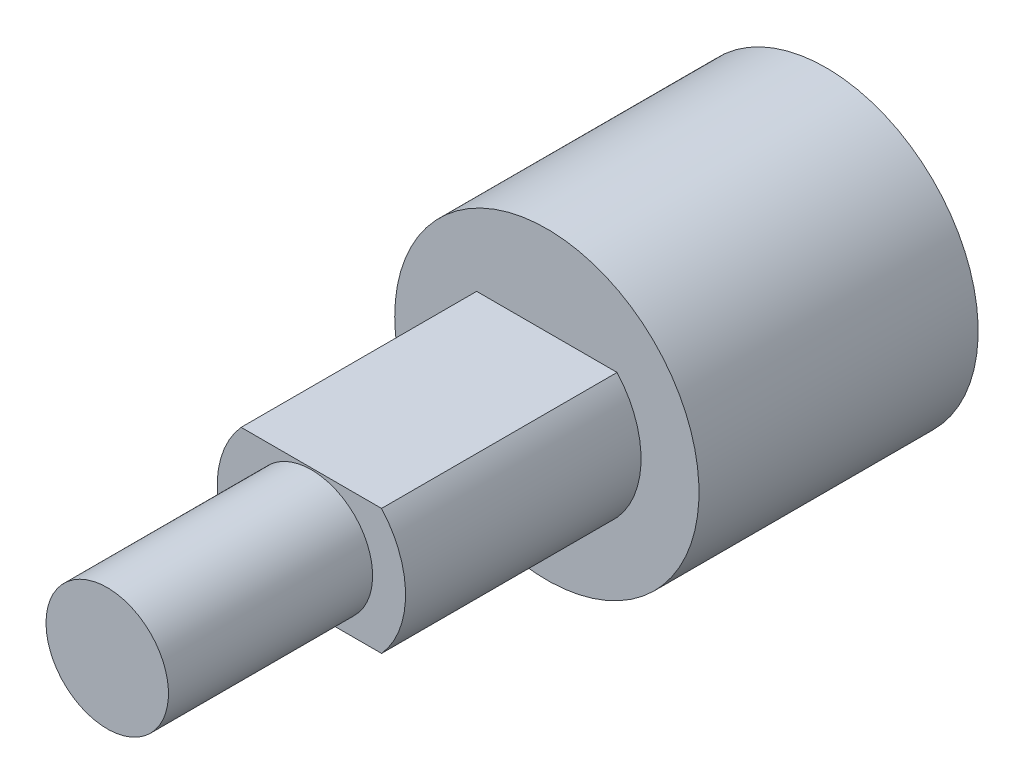
from build123d import *

# Parameters (mm, degrees)
SKETCH1_R           = 4.845
SKETCH1_R_2         = 1.5
BOSS_EXTRUDE1_DEPTH = 8.89
SKETCH2_R           = 1.5
BOSS_EXTRUDE2_DEPTH = 7.5
SKETCH3_R           = 1.95
BOSS_EXTRUDE3_DEPTH = 6.5


with BuildPart() as part:
    # Sketch1 → Boss-Extrude1 (new body)
    with BuildSketch(Plane.XY):
        with Locations(Location((0, 0, 0), (0, 0, 180))):
            Circle(SKETCH1_R)
        with Locations(Location((0, 0, 0), (0, 0, 180))):
            Circle(SKETCH1_R_2, mode=Mode.SUBTRACT)
    extrude(amount=BOSS_EXTRUDE1_DEPTH)

    # Sketch2 → Boss-Extrude2 (add)
    with BuildSketch(Plane.XY.offset(8.89)):
        with BuildLine():
            Line((-2.236067977, 2), (2.236067977, 2))
            ThreePointArc((2.236067977, 2), (3, 0), (2.236067977, -2))
            Line((2.236067977, -2), (-2.236067977, -2))
            ThreePointArc((-2.236067977, -2), (-3, 0), (-2.236067977, 2))
        make_face()
        with Locations(Location((0, 0, 0), (0, 0, 180))):
            Circle(SKETCH2_R, mode=Mode.SUBTRACT)
    extrude(amount=BOSS_EXTRUDE2_DEPTH)

    # Sketch3 → Boss-Extrude3 (add)
    with BuildSketch(Plane.XY.offset(16.39)):
        with Locations(Location((0, 0, 0), (0, 0, 180))):
            Circle(SKETCH3_R)
    extrude(amount=BOSS_EXTRUDE3_DEPTH)


solid = part.part
